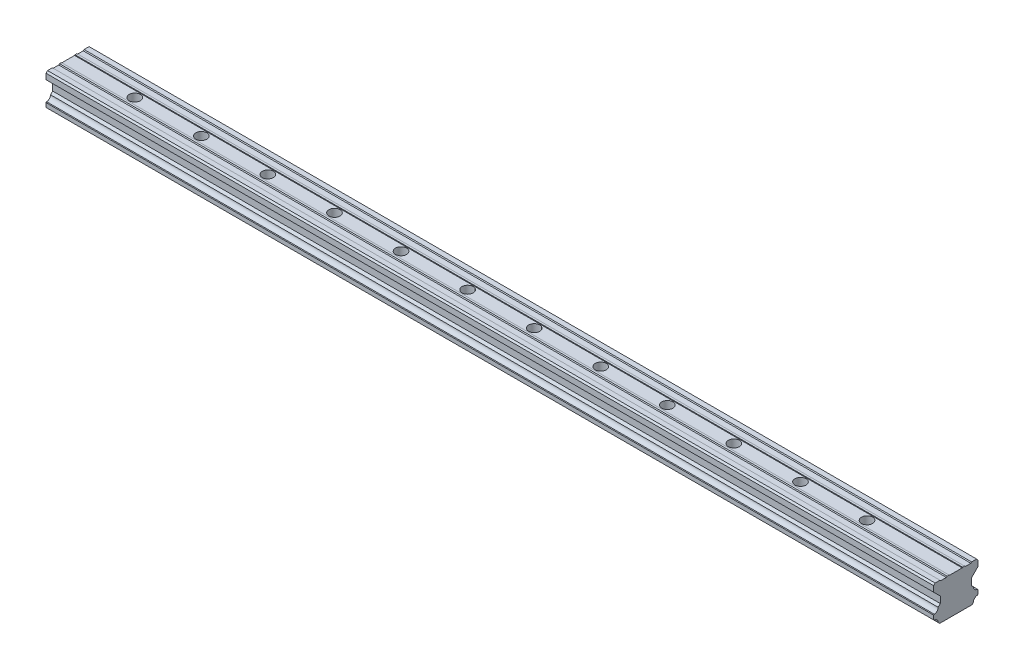
from build123d import *

# Parameters (mm, degrees)
BOSS_EXTRUDE1_DEPTH   = 400
CROQUIS1_R            = 2.5
CORTAR_EXTRUIR1_DEPTH = 401.476966357


with BuildPart() as part:
    # Sketch1 → Boss-Extrude1 (new body)
    with BuildSketch(Plane(origin=(0, 0, 0), x_dir=(0, 0, -1), z_dir=(1, 0, 0))):
        with BuildLine():
            Line((-7.965754986, -7.693975449), (-7.266272068, -8.393458366))
            Line((-7.266272068, -8.393458366), (7.266272068, -8.393458366))
            Line((7.266272068, -8.393458366), (7.965754986, -7.693975449))
            ThreePointArc((7.965754986, -7.693975449), (8.474723757, -6.421557866), (9.747437917, -5.913331162))
            Line((9.747437917, -5.913331162), (10.000000437, -5.660768637))
            Line((10.000000437, -5.660768637), (10.000000437, -3.788406023))
            Line((10.000000437, -3.788406023), (9.747437912, -3.535843503))
            ThreePointArc((9.747437912, -3.535843503), (8.462742055, -3.016656911), (7.965755402, -1.72321096))
            Line((7.965755402, -1.72321096), (7.005148341, -0.762603918))
            Line((7.005148341, -0.762603918), (7.005148341, 2.166206023))
            Line((7.005148341, 2.166206023), (10.000000347, 5.161058089))
            Line((10.000000347, 5.161058089), (10.000000347, 7.712387211))
            Line((10.000000347, 7.712387211), (9.408464779, 8.393458268))
            Line((9.408464779, 8.393458268), (7.133016457, 8.393458268))
            Line((7.133016457, 8.393458268), (6.789534443, 8.049976247))
            Line((6.789534443, 8.049976247), (4.271139656, 8.049976247))
            Line((4.271139656, 8.049976247), (3.927707784, 8.393458265))
            Line((3.927707784, 8.393458265), (3.061282509, 8.393458265))
            Line((3.061282509, 8.393458265), (2.872049327, 8.204225079))
            Line((2.872049327, 8.204225079), (-2.87204886, 8.204225079))
            Line((-2.87204886, 8.204225079), (-3.061282046, 8.393458261))
            Line((-3.061282046, 8.393458261), (-3.927707321, 8.393458261))
            Line((-3.927707321, 8.393458261), (-4.271189216, 8.049976359))
            Line((-4.271189216, 8.049976359), (-6.789534095, 8.049976359))
            Line((-6.789534095, 8.049976359), (-7.133016116, 8.393458373))
            Line((-7.133016116, 8.393458373), (-9.30771733, 8.393458373))
            Line((-9.30771733, 8.393458373), (-10, 7.70117569))
            Line((-10, 7.70117569), (-10, 5.161058187))
            Line((-10, 5.161058187), (-7.005147934, 2.166206181))
            Line((-7.005147934, 2.166206181), (-7.005147934, -0.76260376))
            Line((-7.005147934, -0.76260376), (-7.965754986, -1.723210812))
            ThreePointArc((-7.965754986, -1.723210812), (-8.462741848, -3.016656549), (-9.747437477, -3.535843372))
            Line((-9.747437477, -3.535843372), (-10, -3.788405895))
            Line((-10, -3.788405895), (-10, -5.660768509))
            Line((-10, -5.660768509), (-9.747437477, -5.913331032))
            ThreePointArc((-9.747437477, -5.913331032), (-8.474723558, -6.421557943), (-7.965754986, -7.693975449))
        make_face()
    extrude(amount=BOSS_EXTRUDE1_DEPTH)

    # Croquis1 → Cortar-Extruir1 (cut, through all)
    with BuildSketch(Plane.XZ.offset(8.393458366)):
        with Locations(Location((30, 0, 0), (0, 0, 270))):
            Circle(CROQUIS1_R)
        with Locations(Location((60, 0, 0), (0, 0, 270))):
            Circle(CROQUIS1_R)
        with Locations(Location((90, 0, 0), (0, 0, 270))):
            Circle(CROQUIS1_R)
        with Locations(Location((120, 0, 0), (0, 0, 270))):
            Circle(CROQUIS1_R)
        with Locations(Location((150, 0, 0), (0, 0, 270))):
            Circle(CROQUIS1_R)
        with Locations(Location((180, 0, 0), (0, 0, 270))):
            Circle(CROQUIS1_R)
        with Locations(Location((210, 0, 0), (0, 0, 270))):
            Circle(CROQUIS1_R)
        with Locations(Location((240, 0, 0), (0, 0, 270))):
            Circle(CROQUIS1_R)
        with Locations(Location((270, 0, 0), (0, 0, 270))):
            Circle(CROQUIS1_R)
        with Locations(Location((300, 0, 0), (0, 0, 270))):
            Circle(CROQUIS1_R)
        with Locations(Location((330, 0, 0), (0, 0, 270))):
            Circle(CROQUIS1_R)
        with Locations(Location((360, 0, 0), (0, 0, 270))):
            Circle(CROQUIS1_R)
    extrude(amount=-CORTAR_EXTRUIR1_DEPTH, mode=Mode.SUBTRACT)


solid = part.part
